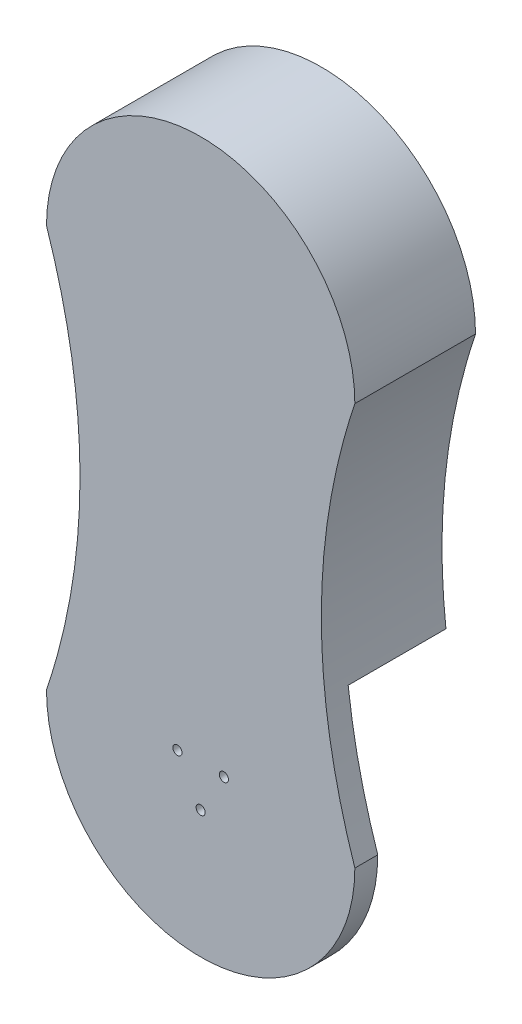
from build123d import *

# Parameters (mm, degrees)
BOSS_EXTRUDE1_DEPTH = 90
SKETCH2_R           = 97.5
CUT_EXTRUDE1_DEPTH  = 72.91
CUT_EXTRUDE10_DEPTH = 72.91
SKETCH13_R          = 3.4
CUT_EXTRUDE13_DEPTH = 17.09


with BuildPart() as part:
    # Sketch1 → Boss-Extrude1 (new body)
    with BuildSketch(Plane(origin=(0, 0, 0), x_dir=(0, 1, 0), z_dir=(0, 0, 1))):
        with BuildLine():
            ThreePointArc((0, 115), (-115, 0), (0, -115))
            add(Edge.make_bspline(
                [(0, -115), (150, -65), (300, -115)],
                knots=[0, 0, 0, 1, 1, 1], degree=2))
            ThreePointArc((300, -115), (415, 0), (300, 115))
            add(Edge.make_bspline(
                [(0, 115), (150, 65), (300, 115)],
                knots=[0, 0, 0, 1, 1, 1], degree=2))
        make_face()
    extrude(amount=BOSS_EXTRUDE1_DEPTH)

    # Sketch2 → Cut-Extrude1 (cut)
    with BuildSketch(Plane(origin=(0, 0, 0), x_dir=(1, 0, 0), z_dir=(0, 0, -1))):
        with Locations(Location((0, 0, 0), (0, 0, 180))):
            Circle(SKETCH2_R)
    extrude(amount=-CUT_EXTRUDE1_DEPTH, mode=Mode.SUBTRACT)

    # Sketch10 → Cut-Extrude10 (cut)
    with BuildSketch(Plane(origin=(0, 0, 0), x_dir=(1, 0, 0), z_dir=(0, 0, -1))):
        with BuildLine():
            ThreePointArc((115, 0), (0, 115), (-115, 0))
            add(Edge.make_bspline(
                [(-92.945702649, -98.510851787), (-98.581524702, -49.255425893), (-115, 0)],
                knots=[0, 0, 0, 1, 1, 1], degree=2))
            ThreePointArc((-92.945702649, -98.510851787), (0, -122.154138558), (92.945702649, -98.510851787))
            add(Edge.make_bspline(
                [(115, 0), (98.581524702, -49.255425893), (92.945702649, -98.510851787)],
                knots=[0, 0, 0, 1, 1, 1], degree=2))
        make_face()
    extrude(amount=-CUT_EXTRUDE10_DEPTH, mode=Mode.SUBTRACT)

    # Sketch13 → Cut-Extrude13 (cut)
    with BuildSketch(Plane(origin=(0, 0, 72.91), x_dir=(1, 0, 0), z_dir=(0, 0, -1))):
        with Locations(Location((0, 20, 0), (0, 0, 180))):
            Circle(SKETCH13_R)
        with Locations(Location((-17.320508076, -10, 0), (0, 0, 180))):
            Circle(SKETCH13_R)
        with Locations(Location((17.320508076, -10, 0), (0, 0, 180))):
            Circle(SKETCH13_R)
    extrude(amount=-CUT_EXTRUDE13_DEPTH, mode=Mode.SUBTRACT)


solid = part.part
